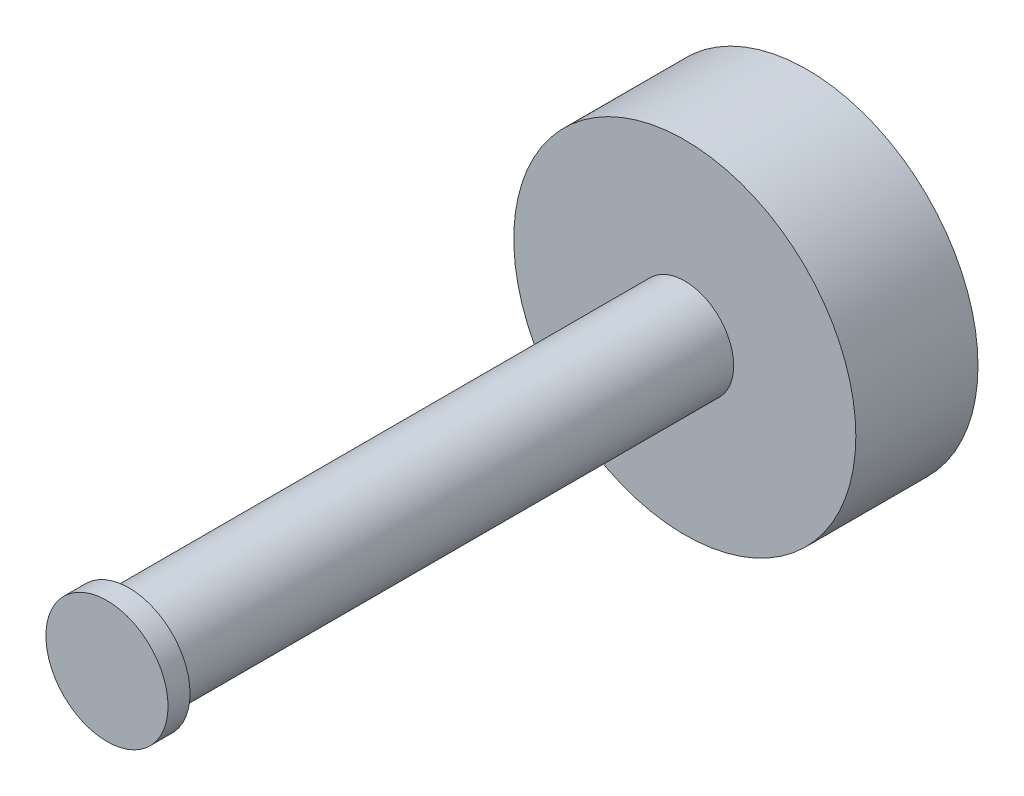
from build123d import *

# Parameters (mm, degrees)
SKETCH1_R                = 14
BOSS_EXTRUDE1_DEPTH      = 10
SKETCH2_R                = 2.25
CUT_EXTRUDE1_DEPTH       = 5
SKETCH3_R                = 5
CUT_EXTRUDE2_DEPTH       = 1.8
SKETCH11_R               = 4
BOSS_EXTRUDE2_DEPTH      = 45.5
ESBO_O2_R                = 5
RESSALTO_EXTRUS_O1_DEPTH = 1.8


with BuildPart() as part:
    # Sketch1 → Boss-Extrude1 (new body)
    with BuildSketch(Plane.XY):
        Circle(SKETCH1_R)
    extrude(amount=BOSS_EXTRUDE1_DEPTH)

    # Sketch2 → Cut-Extrude1 (cut)
    with BuildSketch(Plane(origin=(0, 0, 0), x_dir=(-1, 0, 0), z_dir=(0, 0, -1))):
        Circle(SKETCH2_R)
    extrude(amount=-CUT_EXTRUDE1_DEPTH, mode=Mode.SUBTRACT)

    # Sketch3 → Cut-Extrude2 (cut)
    with BuildSketch(Plane(origin=(0, 0, 0), x_dir=(-1, 0, 0), z_dir=(0, 0, -1))):
        Circle(SKETCH3_R)
    extrude(amount=-CUT_EXTRUDE2_DEPTH, mode=Mode.SUBTRACT)

    # Sketch11 → Boss-Extrude2 (add)
    with BuildSketch(Plane.XY.offset(10)):
        Circle(SKETCH11_R)
    extrude(amount=BOSS_EXTRUDE2_DEPTH)

    # Esboço2 → Ressalto-extrusão1 (add)
    with BuildSketch(Plane.XY.offset(55.5)):
        with Locations(Location((0, 0, 0), (0, 0, 180))):
            Circle(ESBO_O2_R)
    extrude(amount=RESSALTO_EXTRUS_O1_DEPTH)


solid = part.part
